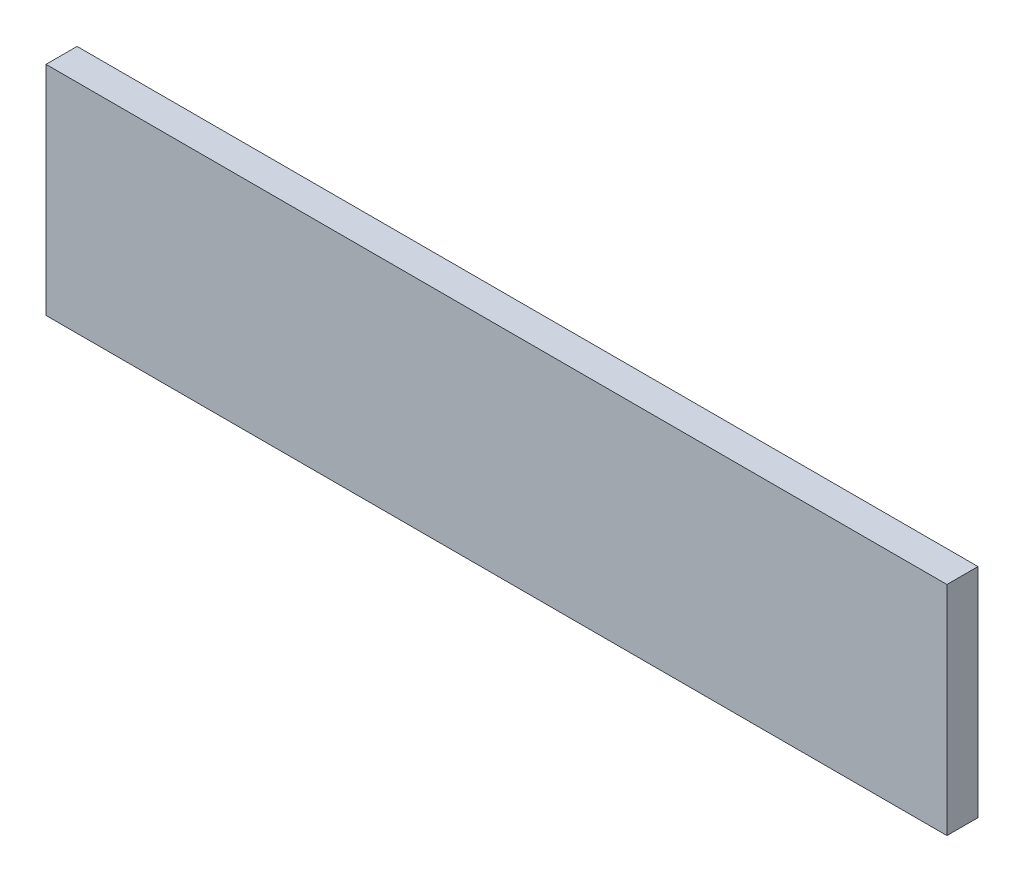
from build123d import *

# Parameters (mm, degrees)
SKETCH2_W           = 184.15
SKETCH2_H           = 44.45
BOSS_EXTRUDE1_DEPTH = 3.175


with BuildPart() as part:
    # Sketch2 → Boss-Extrude1 (new, symmetric)
    with BuildSketch(Plane.XY):
        with Locations((0, 22.225)):
            Rectangle(SKETCH2_W, SKETCH2_H)
    extrude(amount=BOSS_EXTRUDE1_DEPTH, both=True)


solid = part.part
